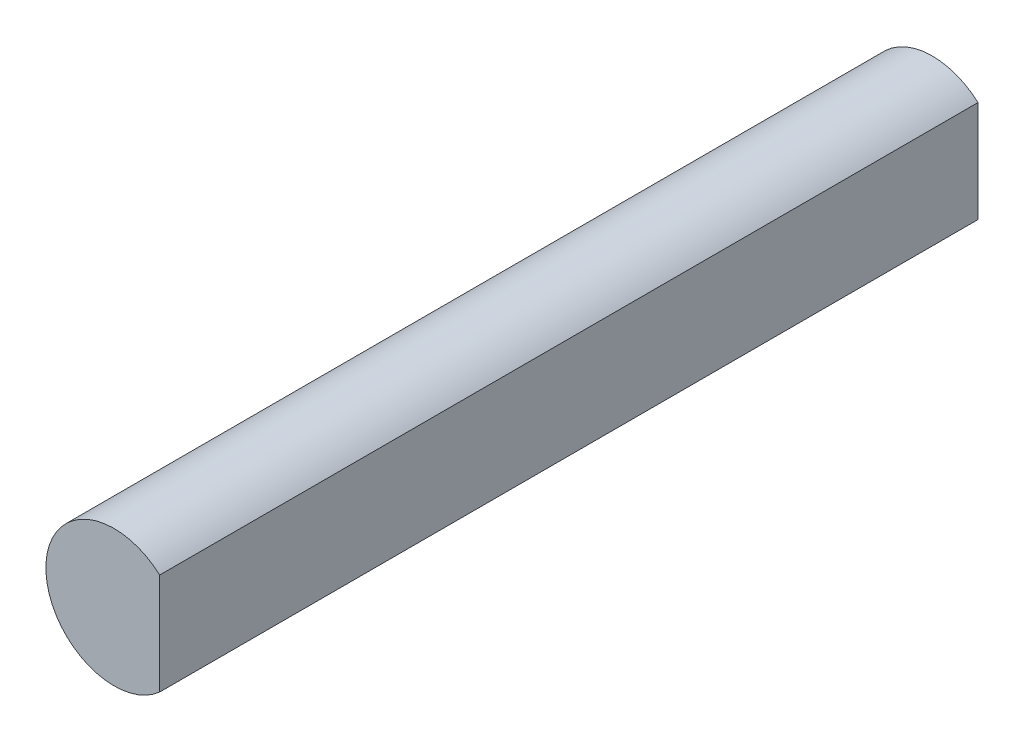
from build123d import *

# Parameters (mm, degrees)
CROQUIS1_R              = 2.5
SALIENTE_EXTRUIR1_DEPTH = 30
CORTAR_EXTRUIR1_DEPTH   = 31.207614934


with BuildPart() as part:
    # Croquis1 → Saliente-Extruir1 (new body)
    with BuildSketch(Plane.XY):
        Circle(CROQUIS1_R)
    extrude(amount=SALIENTE_EXTRUIR1_DEPTH)

    # Croquis2 → Cortar-Extruir1 (cut, through all)
    with BuildSketch(Plane(origin=(0, 0, 0), x_dir=(-1, 0, 0), z_dir=(0, 0, -1))):
        with BuildLine():
            Line((-1.672910403, 1.857786528), (-1.672910403, -1.857786528))
            ThreePointArc((-1.672910403, -1.857786528), (-2.5, 0), (-1.672910403, 1.857786528))
        make_face()
    extrude(amount=-CORTAR_EXTRUIR1_DEPTH, mode=Mode.SUBTRACT)


solid = part.part
